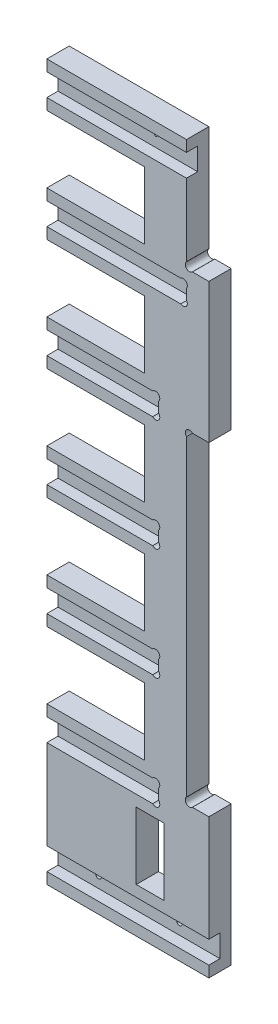
from build123d import *

# Parameters (mm, degrees)
ESQUISSE1_W             = 10
ESQUISSE1_H             = 24
BOSS_EXTRU_1_DEPTH      = 8
ESQUISSE2_W             = 53.566329485
ESQUISSE2_H             = 7.982626226
ESQUISSE2_W_2           = 58
ESQUISSE2_H_2           = 8
ENL_V_MAT_EXTRU_1_DEPTH = 4
ESQUISSE3_R             = 0.5
ESQUISSE3_R_2           = 1
ENL_V_MAT_EXTRU_2_DEPTH = 4


with BuildPart() as part:
    # Esquisse1 → Boss.-Extru.1 (new body)
    with BuildSketch(Plane.XY):
        with BuildLine():
            Line((30.577007139, 186.135890651), (30.577007139, 224.014570308))
            Line((30.577007139, 224.014570308), (-19.422992861, 224.014570308))
            Line((-19.422992861, 224.014570308), (-19.422992861, 208.031944082))
            Line((-19.422992861, 208.031944082), (15.577007139, 208.031944082))
            Line((15.577007139, 208.031944082), (15.577007139, 184.014570308))
            Line((15.577007139, 184.014570308), (-19.422992861, 184.014570308))
            Line((-19.422992861, 184.014570308), (-19.422992861, 168.014570308))
            Line((-19.422992861, 168.014570308), (15.577007139, 168.014570308))
            Line((15.577007139, 168.014570308), (15.577007139, 144.014570308))
            Line((15.577007139, 144.014570308), (-19.422992861, 144.014570308))
            Line((-19.422992861, 144.014570308), (-19.422992861, 128.014570308))
            Line((-19.422992861, 128.014570308), (15.577007139, 128.014570308))
            Line((15.577007139, 128.014570308), (15.577007139, 104.014570308))
            Line((15.577007139, 104.014570308), (-19.422992861, 104.014570308))
            Line((-19.422992861, 104.014570308), (-19.422992861, 88.014570308))
            Line((-19.422992861, 88.014570308), (15.577007139, 88.014570308))
            Line((15.577007139, 88.014570308), (15.577007139, 64.014570308))
            Line((15.577007139, 64.014570308), (-19.422992861, 64.014570308))
            Line((-19.422992861, 64.014570308), (-19.422992861, 48.014570308))
            Line((-19.422992861, 48.014570308), (15.577007139, 48.014570308))
            Line((15.577007139, 48.014570308), (15.577007139, 24.014570308))
            Line((15.577007139, 24.014570308), (-19.422992861, 24.014570308))
            Line((-19.422992861, 24.014570308), (-19.422992861, -31.985429692))
            Line((-19.422992861, -31.985429692), (30.577007139, -31.985429692))
            Line((30.577007139, -31.985429692), (38.577007139, -31.985429692))
            Line((38.577007139, -31.985429692), (38.577007139, 18.014570308))
            Line((38.577007139, 18.014570308), (32.698327483, 18.014570308))
            ThreePointArc((32.698327483, 18.014570308), (30.577007139, 18.014570308), (30.577007139, 20.135890651))
            Line((30.577007139, 20.135890651), (30.577007139, 131.893249964))
            ThreePointArc((30.577007139, 131.893249964), (30.577007139, 134.014570308), (32.698327483, 134.014570308))
            Line((32.698327483, 134.014570308), (38.577007139, 134.014570308))
            Line((38.577007139, 134.014570308), (38.577007139, 184.014570308))
            Line((38.577007139, 184.014570308), (32.698327483, 184.014570308))
            ThreePointArc((32.698327483, 184.014570308), (30.577007139, 184.014570308), (30.577007139, 186.135890651))
        make_face()
        with Locations((17.577007139, -3.985429692)):
            Rectangle(ESQUISSE1_W, ESQUISSE1_H, mode=Mode.SUBTRACT)
    extrude(amount=BOSS_EXTRU_1_DEPTH)

    # Esquisse2 → Enlèv. mat.-Extru.1 (cut)
    with BuildSketch(Plane.XY.offset(8)):
        with BuildLine():
            Line((-19.422992861, 140.014570308), (18.455686796, 140.014570308))
            ThreePointArc((18.455686796, 140.014570308), (20.577007139, 140.014570308), (20.577007139, 137.893249964))
            Line((20.577007139, 137.893249964), (20.577007139, 134.135890651))
            ThreePointArc((20.577007139, 134.135890651), (20.577007139, 132.014570308), (18.455686796, 132.014570308))
            Line((18.455686796, 132.014570308), (-19.422992861, 132.014570308))
            Line((-19.422992861, 132.014570308), (-19.422992861, 140.014570308))
        make_face()
        with BuildLine():
            Line((-19.422992861, 100.014570308), (18.455686796, 100.014570308))
            ThreePointArc((18.455686796, 100.014570308), (20.577007139, 100.014570308), (20.577007139, 97.893249964))
            Line((20.577007139, 97.893249964), (20.577007139, 94.135890651))
            ThreePointArc((20.577007139, 94.135890651), (20.577007139, 92.014570308), (18.455686796, 92.014570308))
            Line((18.455686796, 92.014570308), (-19.422992861, 92.014570308))
            Line((-19.422992861, 92.014570308), (-19.422992861, 100.014570308))
        make_face()
        with BuildLine():
            Line((-19.422992861, 60.014570308), (18.455686796, 60.014570308))
            ThreePointArc((18.455686796, 60.014570308), (20.577007139, 60.014570308), (20.577007139, 57.893249964))
            Line((20.577007139, 57.893249964), (20.577007139, 54.135890651))
            ThreePointArc((20.577007139, 54.135890651), (20.577007139, 52.014570308), (18.455686796, 52.014570308))
            Line((18.455686796, 52.014570308), (-19.422992861, 52.014570308))
            Line((-19.422992861, 52.014570308), (-19.422992861, 60.014570308))
        make_face()
        with BuildLine():
            Line((-19.422992861, 180.014570308), (28.510535818, 180.014570308))
            ThreePointArc((28.510535818, 180.014570308), (30.446580511, 179.833376068), (30.577007139, 177.893249964))
            Line((30.577007139, 177.893249964), (30.577007139, 174.135890651))
            ThreePointArc((30.577007139, 174.135890651), (30.446580511, 172.195764547), (28.510535818, 172.014570308))
            Line((28.510535818, 172.014570308), (-19.422992861, 172.014570308))
            Line((-19.422992861, 172.014570308), (-19.422992861, 180.014570308))
        make_face()
        with BuildLine():
            Line((-19.422992861, 20.014570308), (18.455686796, 20.014570308))
            ThreePointArc((18.455686796, 20.014570308), (20.577007139, 20.014570308), (20.577007139, 17.893249964))
            Line((20.577007139, 17.893249964), (20.577007139, 14.135890651))
            ThreePointArc((20.577007139, 14.135890651), (20.577007139, 12.014570308), (18.455686796, 12.014570308))
            Line((18.455686796, 12.014570308), (-19.422992861, 12.014570308))
            Line((-19.422992861, 12.014570308), (-19.422992861, 20.014570308))
        make_face()
        with Locations((7.360171881, 216.023257195)):
            Rectangle(ESQUISSE2_W, ESQUISSE2_H)
        with Locations((9.577007139, -23.985429692)):
            Rectangle(ESQUISSE2_W_2, ESQUISSE2_H_2)
    extrude(amount=-ENL_V_MAT_EXTRU_1_DEPTH, mode=Mode.SUBTRACT)

    # Esquisse3 → Enlèv. mat.-Extru.2 (cut)
    with BuildSketch(Plane.XY.offset(4)):
        with Locations((15.577007139, 216.023257195)):
            Circle(ESQUISSE3_R)
        with Locations((24.077007139, -23.985429692)):
            Circle(ESQUISSE3_R_2)
        with Locations(Location((-4.922992861, -23.985429692, 0), (0, 0, 180))):
            Circle(ESQUISSE3_R_2)
    extrude(amount=-ENL_V_MAT_EXTRU_2_DEPTH, mode=Mode.SUBTRACT)


solid = part.part
